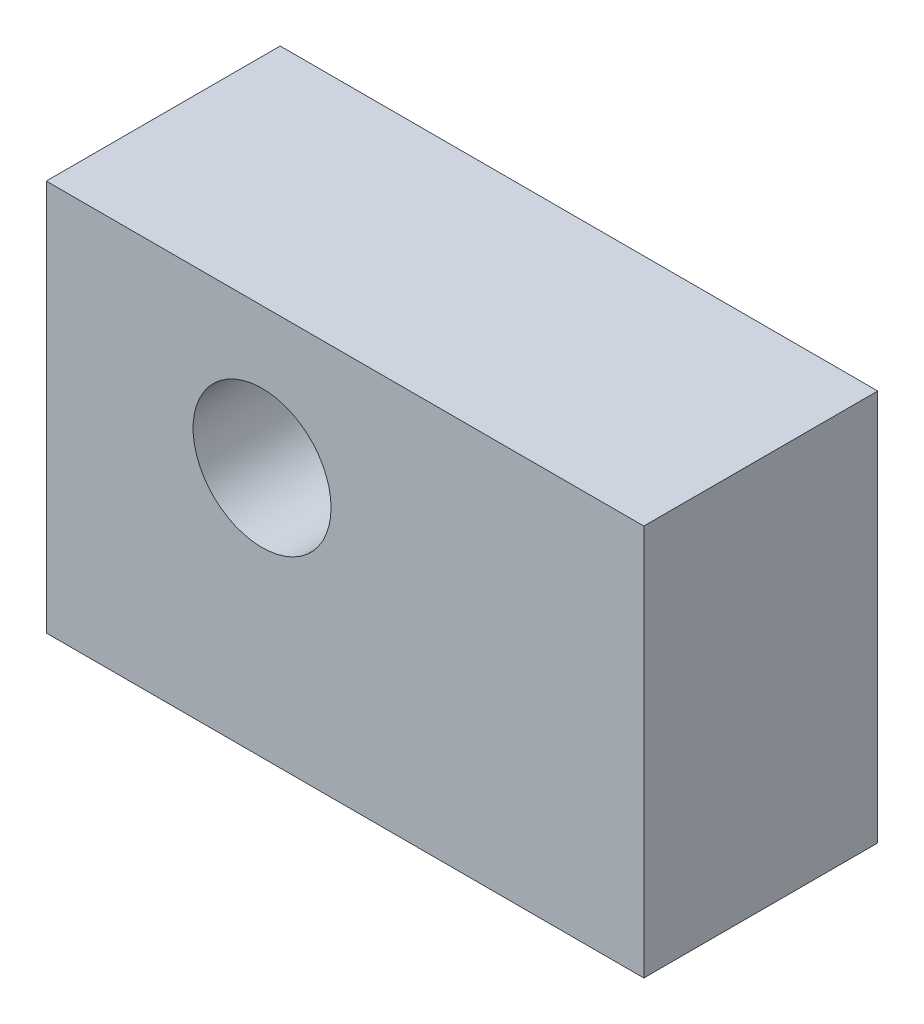
from build123d import *

# Parameters (mm, degrees)
STOCKPROFILE_W       = 71.3
STOCKPROFILE_H       = 46.7
STOCKBOSS_DEPTH      = 13.955
THROUGHPROFILE_R     = 8.23
THROUGHFEATURE_DEPTH = 49.623883278


with BuildPart() as part:
    # StockProfile → StockBoss (new, symmetric)
    with BuildSketch(Plane.XY):
        with Locations((3.17, -2.39)):
            Rectangle(STOCKPROFILE_W, STOCKPROFILE_H)
    extrude(amount=STOCKBOSS_DEPTH, both=True)

    # ThroughProfile → ThroughFeature (cut, through all)
    with BuildSketch(Plane.XY):
        with Locations((-6.73, 4.19)):
            Circle(THROUGHPROFILE_R)
    extrude(amount=THROUGHFEATURE_DEPTH, mode=Mode.SUBTRACT)


solid = part.part
